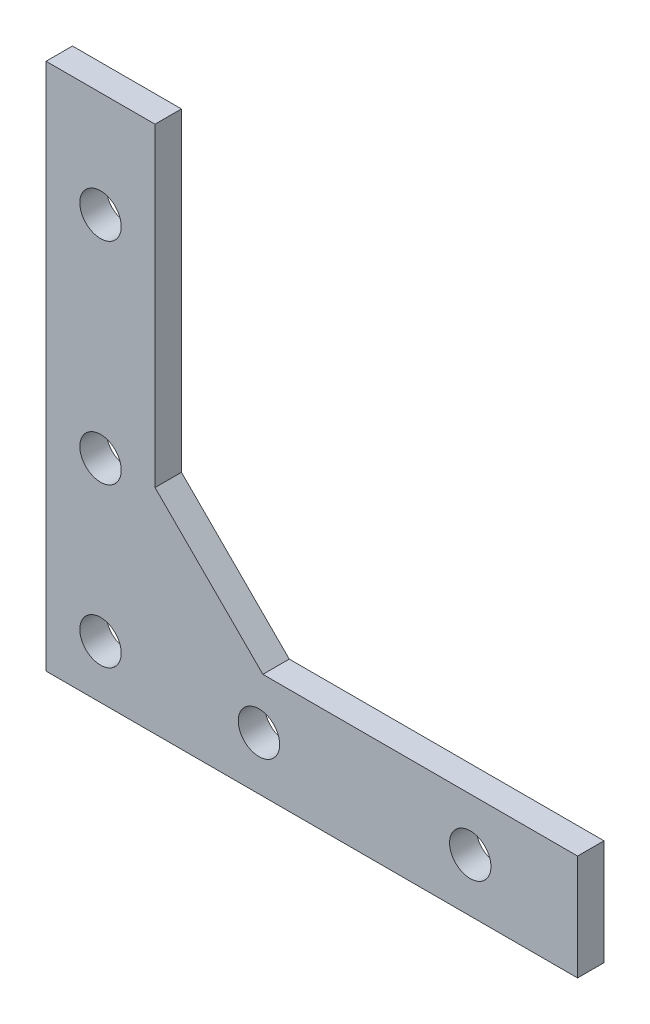
from build123d import *

# Parameters (mm, degrees)
BOSS_EXTRUDE1_DEPTH    = 3.175
F_10_CLEARANCE_HOLE1_D = 4.9784


with BuildPart() as part:
    # Sketch1 → Boss-Extrude1 (new body)
    with BuildSketch(Plane.XY):
        Polygon((-254.000000508, 0), (-267.103367516, 0), (-267.103367516, 63.5), (-254.000000508, 63.5), (-254.000000508, 25.666043074), (-241.033957434, 12.7), (-203.200000508, 12.7), (-203.200000508, 0), align=None)
    extrude(amount=BOSS_EXTRUDE1_DEPTH)

    # #10 Clearance Hole1 (through all)
    with Locations(Plane.XY.offset(3.175)):
        with Locations((-260.551684012, 6.388229415), (-260.551684012, 25.438229415), (-260.551684012, 50.8), (-241.501684012, 6.388229415), (-216.101684012, 6.388229415)):
            Hole(F_10_CLEARANCE_HOLE1_D / 2)


solid = part.part
